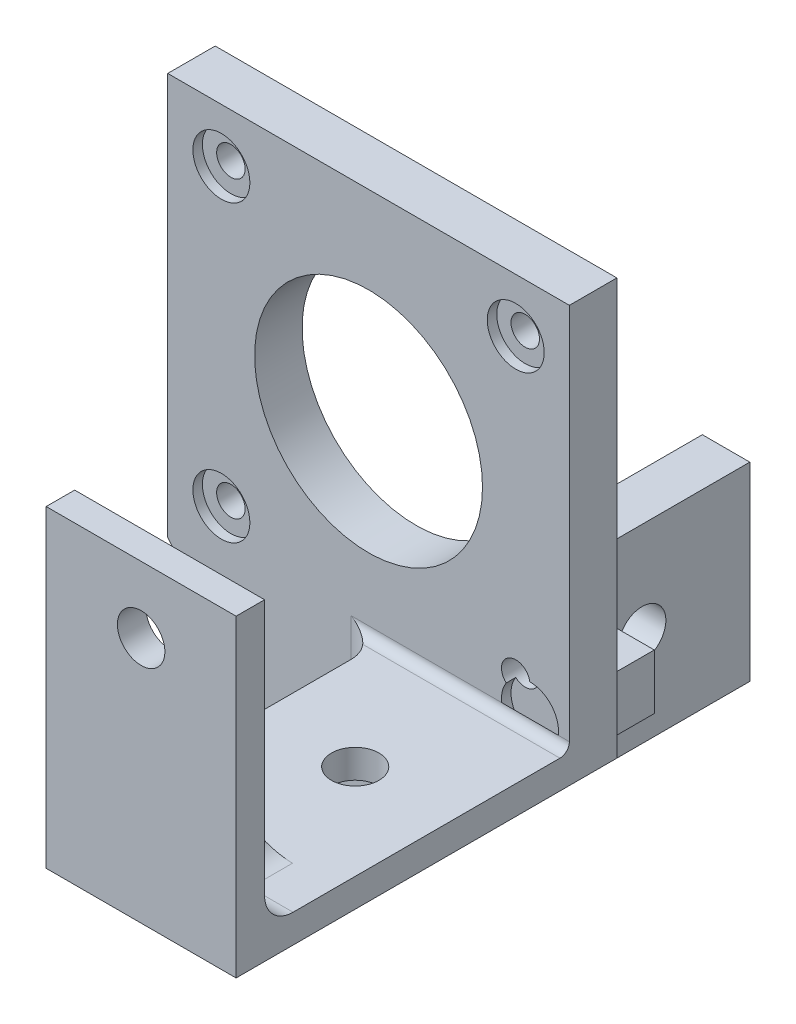
from build123d import *

# Parameters (mm, degrees)
SKETCH_1_R          = 1.5
SKETCH_1_R_2        = 12
EXTRUDE_1_DEPTH     = 5
SKETCH_2_W          = 5
SKETCH_2_H          = 20
EXTRUDE_2_DEPTH     = 34
FILLET_2_R          = 10
SKETCH_4_W          = 20
SKETCH_4_H          = 3
EXTRUDE_3_DEPTH     = 35.1
FILLET_3_R          = 1
SKETCH_5_W          = 20
SKETCH_5_H          = 3
EXTRUDE_4_DEPTH     = 30
RIB_1_REACH         = 83.986
SKETCH_8_WALL_W     = 182.719813126
SKETCH_8_WALL_H     = 5
SKETCH_9_R          = 2.5
CUT_EXTRUDE_1_DEPTH = 30
SKETCH_10_R         = 2.5
CUT_EXTRUDE_2_DEPTH = 30
SKETCH_11_R         = 2.5
CUT_EXTRUDE_3_DEPTH = 30
SKETCH_12_R         = 3
CUT_EXTRUDE_4_DEPTH = 1
SKETCH_13_R         = 4
CUT_EXTRUDE_5_DEPTH = 1
SKETCH_14_W         = 23.937452614
SKETCH_14_H         = 5.8
EXTRUDE_5_DEPTH     = 5
FILLET_4_R          = 3


with BuildPart() as part:
    # 草图1 → 凸台-拉伸1 (new body)
    # profile 1 of 2: a face of its own
    with BuildSketch(Plane.XY):
        Polygon((42.3, 0), (0, 0), (0, -42.3), (17.3, -63.8), (22.3, -63.8), (22.3, -43.8), (42.3, -43.8), (42.3, -42.3), align=None)
        with Locations((5.65, -36.65)):
            Circle(SKETCH_1_R, mode=Mode.SUBTRACT)
        with Locations((36.65, -36.65)):
            Circle(SKETCH_1_R, mode=Mode.SUBTRACT)
        with Locations((21.15, -21.15)):
            Circle(SKETCH_1_R_2, mode=Mode.SUBTRACT)
        with Locations((5.65, -5.65)):
            Circle(SKETCH_1_R, mode=Mode.SUBTRACT)
        with Locations((36.65, -5.65)):
            Circle(SKETCH_1_R, mode=Mode.SUBTRACT)
    # profile 2 of 2: a face of its own
    with BuildSketch(Plane.XY):
        Polygon((42.3, 0), (0, 0), (0, -42.3), (17.3, -63.8), (22.3, -63.8), (22.3, -43.8), (42.3, -43.8), (42.3, -42.3), align=None)
        with Locations((5.65, -36.65)):
            Circle(SKETCH_1_R, mode=Mode.SUBTRACT)
        with Locations((36.65, -36.65)):
            Circle(SKETCH_1_R, mode=Mode.SUBTRACT)
        with Locations((21.15, -21.15)):
            Circle(SKETCH_1_R_2, mode=Mode.SUBTRACT)
        with Locations((5.65, -5.65)):
            Circle(SKETCH_1_R, mode=Mode.SUBTRACT)
        with Locations((36.65, -5.65)):
            Circle(SKETCH_1_R, mode=Mode.SUBTRACT)
    extrude(amount=EXTRUDE_1_DEPTH)

    # 草图2 → 凸台-拉伸2 (add)
    with BuildSketch(Plane(origin=(0, 0, 0), x_dir=(-1, 0, 0), z_dir=(0, 0, -1))):
        with Locations((-19.8, -53.8)):
            Rectangle(SKETCH_2_W, SKETCH_2_H)
    extrude(amount=EXTRUDE_2_DEPTH)

    # 圆角2
    fillet_2_edges = [part.edges().sort_by_distance(p)[0] for p in [
        (17.3, -53.8, 0),
    ]]
    fillet(fillet_2_edges, radius=FILLET_2_R)

    # 草图4 → 凸台-拉伸3 (add)
    with BuildSketch(Plane.XY.offset(5)):
        with Locations((32.3, -42.3)):
            Rectangle(SKETCH_4_W, SKETCH_4_H)
    extrude(amount=EXTRUDE_3_DEPTH)

    # 圆角3
    fillet_3_edges = [part.edges().sort_by_distance(p)[0] for p in [
        (32.3, -40.8, 5),
    ]]
    fillet(fillet_3_edges, radius=FILLET_3_R)

    # 草图5 → 凸台-拉伸4 (add)
    with BuildSketch(Plane(origin=(0, -40.8, 0), x_dir=(1, 0, 0), z_dir=(0, 1, 0))):
        with Locations((32.3, -38.6)):
            Rectangle(SKETCH_5_W, SKETCH_5_H)
    extrude(amount=EXTRUDE_4_DEPTH)

    # 草图8 wall → 筋1 (add, up to next)
    with BuildSketch(Plane(origin=(32.3, -33.3, 33.375935793), x_dir=(0, -0.895662677282, -0.444734042461), z_dir=(0, 0.444734042461, -0.895662677282)), mode=Mode.PRIVATE) as rib_1_sk1:
        Rectangle(SKETCH_8_WALL_W, SKETCH_8_WALL_H)
    rib_1_tool1 = extrude(rib_1_sk1.sketch, amount=-RIB_1_REACH, mode=Mode.PRIVATE) - part.part
    add(rib_1_tool1.solids().sort_by_distance((32.3, -33.3, 33.375935793))[0])

    # 草图9 → 切除-拉伸1 (cut)
    with BuildSketch(Plane.XY.offset(40.1)):
        with Locations((32.3, -17.795537052)):
            Circle(SKETCH_9_R)
    extrude(amount=-CUT_EXTRUDE_1_DEPTH, mode=Mode.SUBTRACT)

    # 草图10 → 切除-拉伸2 (cut)
    with BuildSketch(Plane(origin=(0, -40.8, 0), x_dir=(1, 0, 0), z_dir=(0, 1, 0))):
        with Locations(Location((32.3, -17.555140143, 0), (0, 0, 270))):
            Circle(SKETCH_10_R)
    extrude(amount=-CUT_EXTRUDE_2_DEPTH, mode=Mode.SUBTRACT)

    # 草图11 → 切除-拉伸3 (cut)
    with BuildSketch(Plane.ZY.offset(-17.3)):
        with Locations((-22.658194914, -53.8)):
            Circle(SKETCH_11_R)
    extrude(amount=-CUT_EXTRUDE_3_DEPTH, mode=Mode.SUBTRACT)

    # 草图12 → 切除-拉伸4 (cut)
    with BuildSketch(Plane.XY.offset(5)):
        with Locations((5.65, -5.65)):
            Circle(SKETCH_12_R)
        with Locations((36.65, -5.65)):
            Circle(SKETCH_12_R)
        with Locations((5.65, -36.65)):
            Circle(SKETCH_12_R)
        with Locations((38.15, -39.419310808)):
            Circle(SKETCH_12_R)
    extrude(amount=-CUT_EXTRUDE_4_DEPTH, mode=Mode.SUBTRACT)

    # 草图13 → 切除-拉伸5 (cut)
    with BuildSketch(Plane.ZY.offset(-17.3)):
        with Locations((-22.658194914, -53.8)):
            Circle(SKETCH_13_R)
    extrude(amount=-CUT_EXTRUDE_5_DEPTH, mode=Mode.SUBTRACT)

    # 草图14 → 凸台-拉伸5 (add)
    with BuildSketch(Plane(origin=(22.3, 0, 0), x_dir=(0, 0, -1), z_dir=(1, 0, 0))):
        with Locations((6.968726307, -53.8)):
            Rectangle(SKETCH_14_W, SKETCH_14_H)
    extrude(amount=EXTRUDE_5_DEPTH)

    # 圆角4
    fillet_4_edges = [part.edges().sort_by_distance(p)[0] for p in [
        (26.05, -40.8, 37.1),
        (38.55, -40.8, 37.1),
        (34.8, -40.8, 33.375935793),
        (34.8, -33.300000001, 37.1),
        (29.8, -40.8, 33.375935793),
        (29.8, -33.300000001, 37.1),
        (22.3, -41.8, 5),
        (14.8, -43.8, 0),
    ]]
    fillet(fillet_4_edges, radius=FILLET_4_R)


solid = part.part
